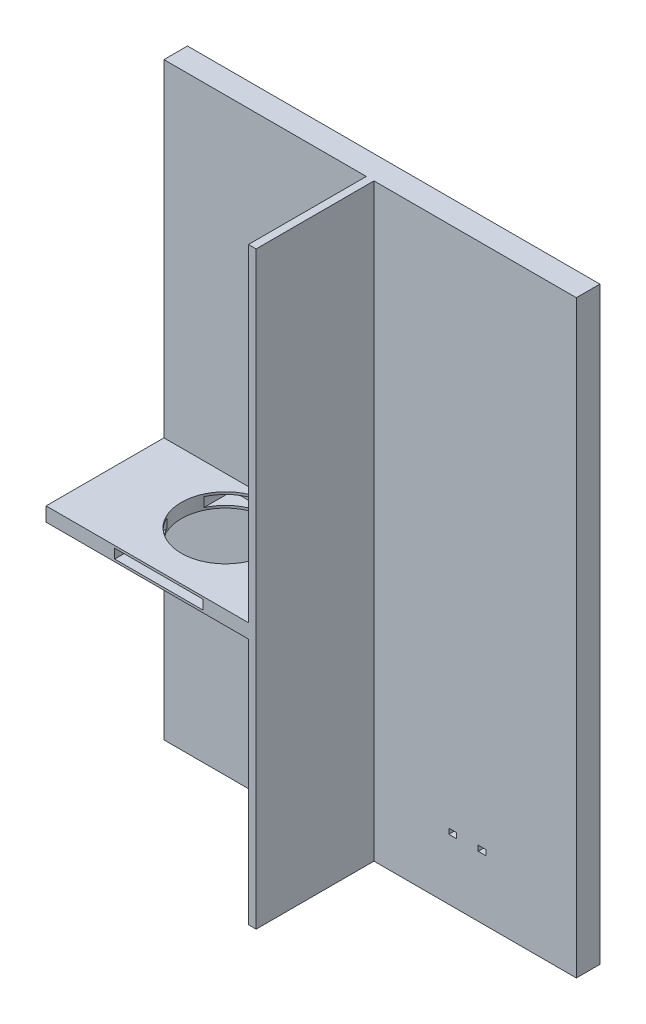
from build123d import *

# Parameters (mm, degrees)
IZIM1_W                     = 35
IZIM1_H                     = 50
IZIM1_W_2                   = 0.6
IZIM1_H_2                   = 0.6
IZIM1_W_3                   = 0.65
IZIM1_H_3                   = 0.45
Y_KSEKLIK_EKSTR_ZYON1_DEPTH = 2
IZIM2_W                     = 0.65
IZIM2_H                     = 50
Y_KSEKLIK_EKSTR_ZYON2_DEPTH = 10
IZIM3_W                     = 10
IZIM3_H                     = 1.2
Y_KSEKLIK_EKSTR_ZYON3_DEPTH = 17.175
IZIM4_W                     = 7.5
IZIM4_H                     = 0.8
KES_EKSTR_ZYON1_DEPTH       = 10
KES_EKSTR_ZYON2_REACH       = 49.011
IZIM5_RX                    = 3.75
IZIM5_RY                    = 3.75


with BuildPart() as part:
    # Çizim1 → Yükseklik-Ekstrüzyon1 (new body)
    with BuildSketch(Plane.XY):
        with Locations((17.5, 25)):
            Rectangle(IZIM1_W, IZIM1_H)
        with Locations((8.3, 5.703429896)):
            Rectangle(IZIM1_W_2, IZIM1_H_2, mode=Mode.SUBTRACT)
        with Locations((10.84, 5.703429896)):
            Rectangle(IZIM1_W_2, IZIM1_H_2, mode=Mode.SUBTRACT)
        with Locations((27, 5.375)):
            Rectangle(IZIM1_W_3, IZIM1_H_3, mode=Mode.SUBTRACT)
        with Locations((24.5, 5.375)):
            Rectangle(IZIM1_W_3, IZIM1_H_3, mode=Mode.SUBTRACT)
    extrude(amount=Y_KSEKLIK_EKSTR_ZYON1_DEPTH)

    # Çizim2 → Yükseklik-Ekstrüzyon2 (add)
    with BuildSketch(Plane.XY.offset(2)):
        with Locations((17.5, 25)):
            Rectangle(IZIM2_W, IZIM2_H)
    extrude(amount=Y_KSEKLIK_EKSTR_ZYON2_DEPTH)

    # Çizim3 → Yükseklik-Ekstrüzyon3 (add, through all)
    with BuildSketch(Plane.ZY.offset(-17.175)):
        with Locations((7, 21.6)):
            Rectangle(IZIM3_W, IZIM3_H)
    extrude(amount=Y_KSEKLIK_EKSTR_ZYON3_DEPTH)

    # Çizim4 → Kes-Ekstrüzyon1 (cut)
    with BuildSketch(Plane.XY.offset(12)):
        with Locations((9.57, 21.6)):
            Rectangle(IZIM4_W, IZIM4_H)
    extrude(amount=-KES_EKSTR_ZYON1_DEPTH, mode=Mode.SUBTRACT)

    # Çizim5 → Kes-Ekstrüzyon2 (cut, up to next)
    with BuildSketch(Plane.XZ.offset(-21), mode=Mode.PRIVATE) as kes_ekstr_zyon2_sk1:
        with Locations(Location((9.224839589, 6), (0, 0, 180))):
            Ellipse(IZIM5_RX, IZIM5_RY)
    kes_ekstr_zyon2_tool1 = extrude(kes_ekstr_zyon2_sk1.sketch, amount=-KES_EKSTR_ZYON2_REACH, mode=Mode.PRIVATE) & part.part
    add(kes_ekstr_zyon2_tool1.solids().sort_by_distance((9.22484, 21, 6))[0], mode=Mode.SUBTRACT)


solid = part.part
